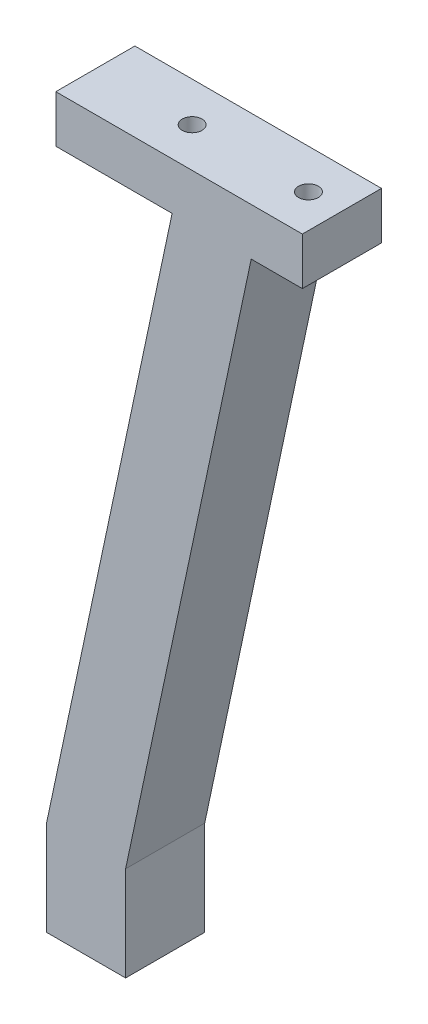
from build123d import *

# Parameters (mm, degrees)
SKETCH1_W           = 17
SKETCH1_H           = 17
SKETCH3_W           = 53
SKETCH3_H           = 17
BOSS_EXTRUDE1_DEPTH = 10.16
SKETCH4_W           = 7
SKETCH4_H           = 7
SKETCH6_R           = 2.125
CUT_EXTRUDE1_DEPTH  = 135.76512419
SKETCH7_R           = 3.3
CUT_EXTRUDE2_DEPTH  = 3
SKETCH8_W           = 4
SKETCH8_H           = 20
CUT_EXTRUDE3_DEPTH  = 2
SKETCH9_W           = 17
SKETCH9_H           = 17
BOSS_EXTRUDE2_DEPTH = 20.32
SKETCH10_R          = 1.6764
CUT_EXTRUDE4_DEPTH  = 15.24


with BuildPart() as part:
    # Sweep1: sweep along a path in Sketch2
    with BuildLine(Plane.XY) as sweep1_path:
        Line((-10.900401277, 0), (16.094282055, 127))
    # Sketch1 → Sweep1 (sweep)
    with BuildSketch(Plane(origin=(0, 0, 0), x_dir=(1, 0, 0), z_dir=(0, 1, 0))):
        with Locations((-2.400401277, 0.898563086)):
            Rectangle(SKETCH1_W, SKETCH1_H)
    sweep(path=sweep1_path.line)

    # Sketch3 → Boss-Extrude1 (add)
    with BuildSketch(Plane(origin=(0, 127, 0), x_dir=(1, 0, 0), z_dir=(0, 1, 0))):
        with Locations((17.594282055, 0.898563086)):
            Rectangle(SKETCH3_W, SKETCH3_H)
    extrude(amount=BOSS_EXTRUDE1_DEPTH)

    # Cut-Sweep1: sweep along a path in Sketch5
    with BuildLine(Plane.XY.offset(7.601436914)) as cut_sweep1_path:
        Line((-5.900401277, 0), (9.942469563, 74.534847176))
    # Sketch4 → Cut-Sweep1 (sweep, cut)
    with BuildSketch(Plane.XZ):
        with Locations((-2.400401277, -0.898563086)):
            Rectangle(SKETCH4_W, SKETCH4_H)
    sweep(path=cut_sweep1_path.line, mode=Mode.SUBTRACT)

    # Sketch6 → Cut-Extrude1 (cut, through all)
    with BuildSketch(Plane.XZ.offset(-127)):
        with Locations(Location((36.894282055, -0.898563086, 0), (0, 0, 270))):
            Circle(SKETCH6_R)
        with Locations(Location((11.894282055, -0.898563086, 0), (0, 0, 270))):
            Circle(SKETCH6_R)
    extrude(amount=-CUT_EXTRUDE1_DEPTH, mode=Mode.SUBTRACT)

    # Sketch7 → Cut-Extrude2 (cut)
    with BuildSketch(Plane.XZ.offset(-127)):
        with Locations(Location((11.894282055, -0.898563086, 0), (0, 0, 270))):
            Circle(SKETCH7_R)
        with Locations(Location((36.894282055, -0.898563086, 0), (0, 0, 270))):
            Circle(SKETCH7_R)
    extrude(amount=-CUT_EXTRUDE2_DEPTH, mode=Mode.SUBTRACT)

    # Sketch8 → Cut-Extrude3 (cut)
    with BuildSketch(Plane(origin=(-10.429206675, 2.216796312, 0), x_dir=(0, 0, 1), z_dir=(-0.9781476007338064, 0.20791169081775596, 0))):
        with Locations((-0.898563086, 117.570934688)):
            Rectangle(SKETCH8_W, SKETCH8_H)
    extrude(amount=-CUT_EXTRUDE3_DEPTH, mode=Mode.SUBTRACT)

    # Sketch9 → Boss-Extrude2 (add)
    with BuildSketch(Plane.XZ):
        with Locations((-2.400401277, -0.898563086)):
            Rectangle(SKETCH9_W, SKETCH9_H)
    extrude(amount=BOSS_EXTRUDE2_DEPTH)

    # Sketch10 → Cut-Extrude4 (cut)
    with BuildSketch(Plane.XZ.offset(20.32)):
        with Locations(Location((-2.400401277, -0.898563086, 0), (0, 0, 270))):
            Circle(SKETCH10_R)
    extrude(amount=-CUT_EXTRUDE4_DEPTH, mode=Mode.SUBTRACT)


solid = part.part
